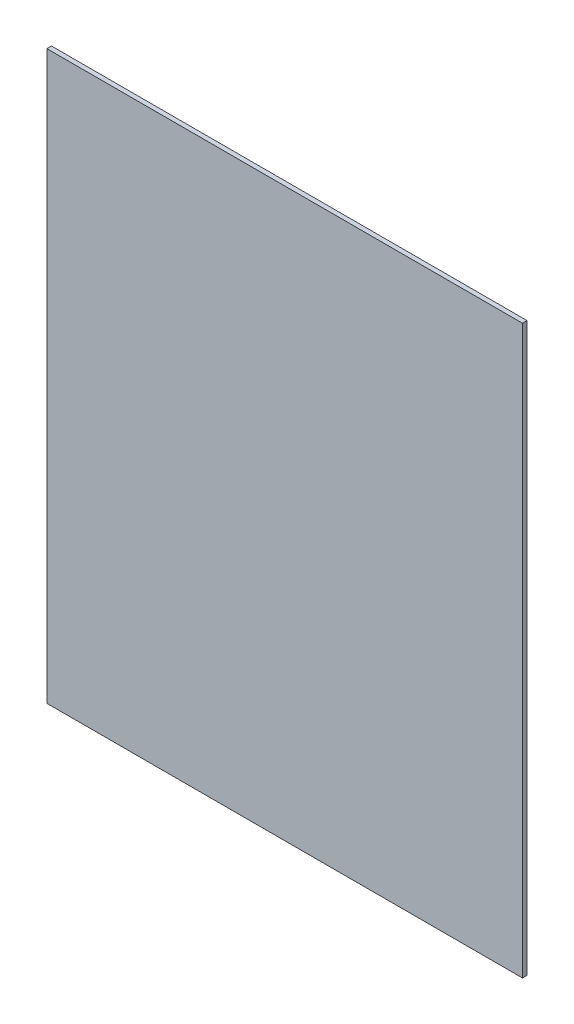
from build123d import *

# Parameters (mm, degrees)
SKETCH1_W           = 165.1
SKETCH1_H           = 196.85
BOSS_EXTRUDE1_DEPTH = 1.5875


with BuildPart() as part:
    # Sketch1 → Boss-Extrude1 (new body)
    with BuildSketch(Plane.XY):
        with Locations((-82.55, 98.425)):
            Rectangle(SKETCH1_W, SKETCH1_H)
    extrude(amount=BOSS_EXTRUDE1_DEPTH)


solid = part.part
